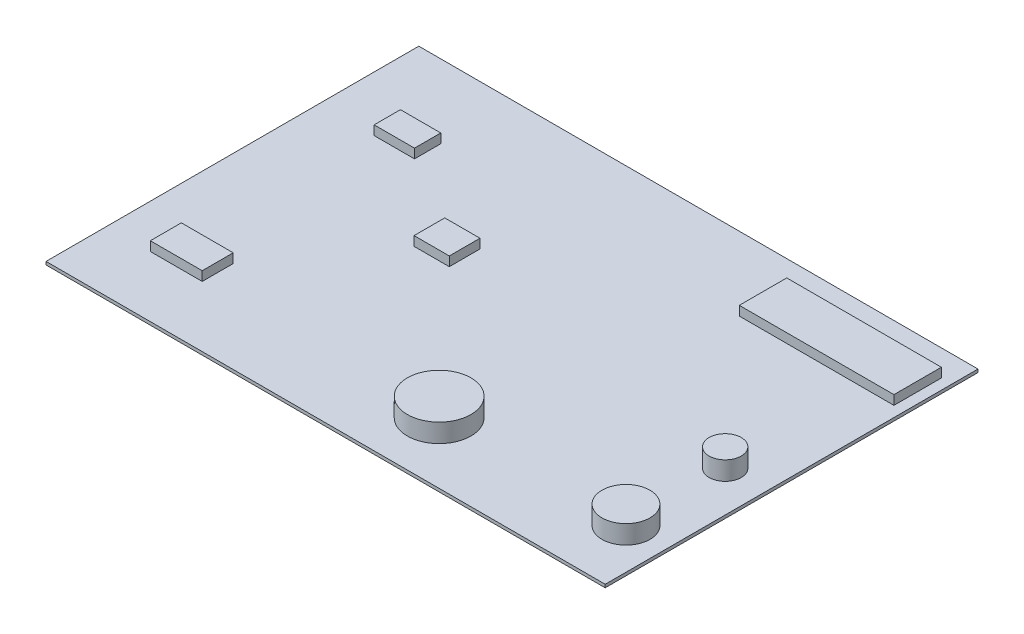
from build123d import *

# Parameters (mm, degrees)
SKETCH_1_W      = 180
SKETCH_1_H      = 120
EXTRUDE_1_DEPTH = 1
SKETCH_2_W      = 12.985294312
SKETCH_2_H      = 8.457960927
SKETCH_2_W_2    = 16.701200635
SKETCH_2_H_2    = 9.980115798
SKETCH_2_W_3    = 11.334837972
SKETCH_2_H_3    = 9.873617341
SKETCH_2_W_4    = 49.777064572
SKETCH_2_H_4    = 15.269655747
EXTRUDE_2_DEPTH = 3
SKETCH_3_R      = 5.164314182
SKETCH_3_R_2    = 7.724932849
SKETCH_3_R_3    = 10.233859985
EXTRUDE_3_DEPTH = 6


with BuildPart() as part:
    # 草图1 → 凸台-拉伸1 (new body)
    with BuildSketch(Plane(origin=(0, 0, 0), x_dir=(1, 0, 0), z_dir=(0, 1, 0))):
        Rectangle(SKETCH_1_W, SKETCH_1_H)
    extrude(amount=EXTRUDE_1_DEPTH)

    # 草图2 → 凸台-拉伸2 (add)
    with BuildSketch(Plane(origin=(0, 1, 0), x_dir=(1, 0, 0), z_dir=(0, 1, 0))):
        with Locations((-65.761091414, 32.109327308)):
            Rectangle(SKETCH_2_W, SKETCH_2_H)
        with Locations((-67.619044575, -35.458648807)):
            Rectangle(SKETCH_2_W_2, SKETCH_2_H_2)
        with Locations((-29.284234399, 8.367215504)):
            Rectangle(SKETCH_2_W_3, SKETCH_2_H_3)
        with Locations((61.715173055, 43.973135646)):
            Rectangle(SKETCH_2_W_4, SKETCH_2_H_4)
    extrude(amount=EXTRUDE_2_DEPTH)

    # 草图3 → 凸台-拉伸3 (add)
    with BuildSketch(Plane(origin=(0, 1, 0), x_dir=(1, 0, 0), z_dir=(0, 1, 0))):
        with Locations(Location((76.981635132, -8.358638316, 0), (0, 0, 90))):
            Circle(SKETCH_3_R)
        with Locations(Location((76.981635132, -40.295684365, 0), (0, 0, 90))):
            Circle(SKETCH_3_R_2)
        with Locations(Location((16.847486271, -40.295684365, 0), (0, 0, 90))):
            Circle(SKETCH_3_R_3)
    extrude(amount=EXTRUDE_3_DEPTH)


solid = part.part
